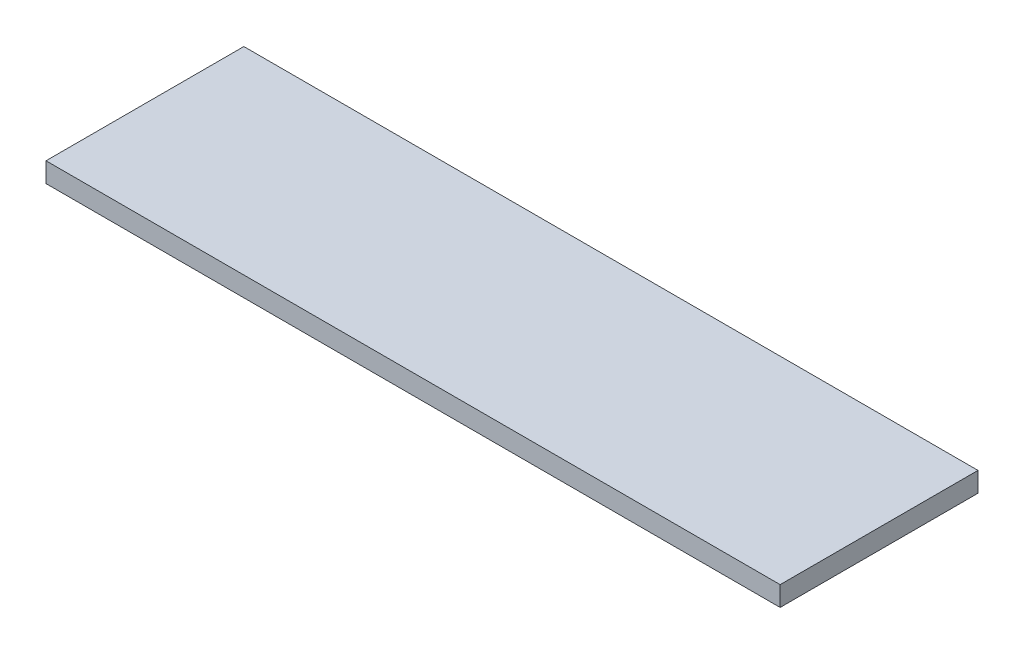
from build123d import *

# Parameters (mm, degrees)
SKETCH1_W           = 250
SKETCH1_H           = 40
BOSS_EXTRUDE1_DEPTH = 4
SKETCH4_W           = 126.947942507
SKETCH4_H           = 53.258076658
CUT_EXTRUDE3_DEPTH  = 10


with BuildPart() as part:
    # Sketch1 → Boss-Extrude1 (new body)
    with BuildSketch(Plane(origin=(0, 0, 0), x_dir=(1, 0, 0), z_dir=(0, 1, 0))):
        with Locations((-25.628547234, -36.520233304)):
            Rectangle(SKETCH1_W, SKETCH1_H)
    extrude(amount=BOSS_EXTRUDE1_DEPTH)

    # Sketch4 → Cut-Extrude3 (cut)
    with BuildSketch(Plane.XZ):
        with Locations((-112.52377638, 34.958755358)):
            Rectangle(SKETCH4_W, SKETCH4_H)
    extrude(amount=-CUT_EXTRUDE3_DEPTH, mode=Mode.SUBTRACT)


solid = part.part
